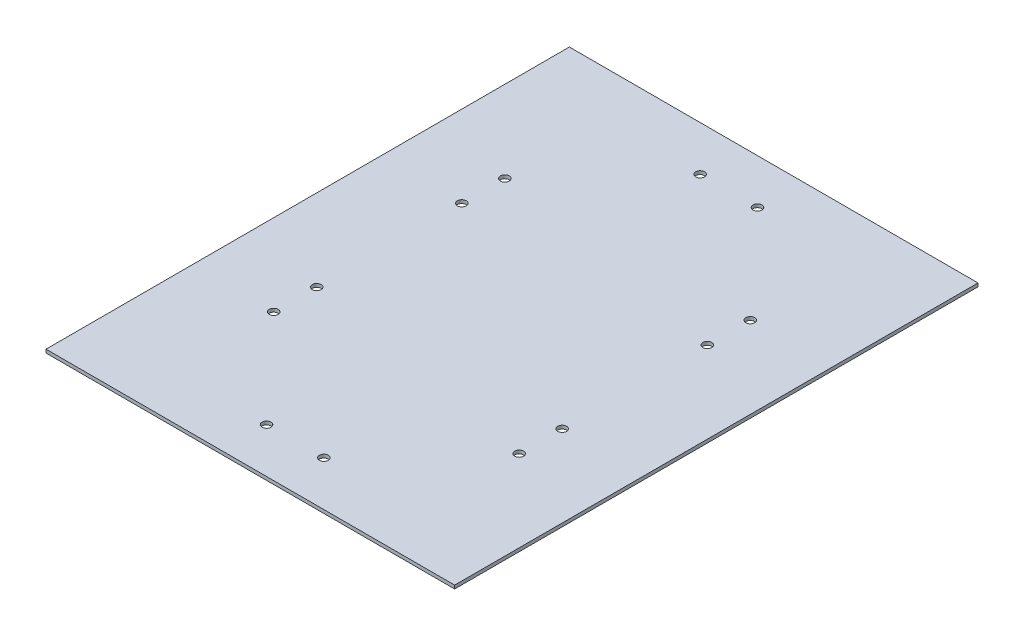
from build123d import *

# Parameters (mm, degrees)
SKETCH1_W           = 361.95
SKETCH1_H           = 463.55
SKETCH1_R           = 3.937
BOSS_EXTRUDE1_DEPTH = 3


with BuildPart() as part:
    # Sketch1 → Boss-Extrude1 (new body)
    with BuildSketch(Plane(origin=(0, 0, 0), x_dir=(1, 0, 0), z_dir=(0, 1, 0))):
        Rectangle(SKETCH1_W, SKETCH1_H)
        with Locations(Location((-108.712, 64.262, 0), (0, 0, 270))):
            Circle(SKETCH1_R, mode=Mode.SUBTRACT)
        with Locations(Location((-108.712, 102.362, 0), (0, 0, 270))):
            Circle(SKETCH1_R, mode=Mode.SUBTRACT)
        with Locations(Location((-108.712, -102.362, 0), (0, 0, 90))):
            Circle(SKETCH1_R, mode=Mode.SUBTRACT)
        with Locations(Location((-108.712, -64.262, 0), (0, 0, 90))):
            Circle(SKETCH1_R, mode=Mode.SUBTRACT)
        with Locations(Location((-25.4, 192.024, 0), (0, 0, 270))):
            Circle(SKETCH1_R, mode=Mode.SUBTRACT)
        with Locations(Location((-25.4, -192.024, 0), (0, 0, 90))):
            Circle(SKETCH1_R, mode=Mode.SUBTRACT)
        with Locations(Location((25.4, -192.024, 0), (0, 0, 270))):
            Circle(SKETCH1_R, mode=Mode.SUBTRACT)
        with Locations(Location((108.712, -64.262, 0), (0, 0, 270))):
            Circle(SKETCH1_R, mode=Mode.SUBTRACT)
        with Locations(Location((108.712, -102.362, 0), (0, 0, 270))):
            Circle(SKETCH1_R, mode=Mode.SUBTRACT)
        with Locations(Location((25.4, 192.024, 0), (0, 0, 90))):
            Circle(SKETCH1_R, mode=Mode.SUBTRACT)
        with Locations(Location((108.712, 102.362, 0), (0, 0, 90))):
            Circle(SKETCH1_R, mode=Mode.SUBTRACT)
        with Locations(Location((108.712, 64.262, 0), (0, 0, 90))):
            Circle(SKETCH1_R, mode=Mode.SUBTRACT)
    extrude(amount=BOSS_EXTRUDE1_DEPTH)


solid = part.part
